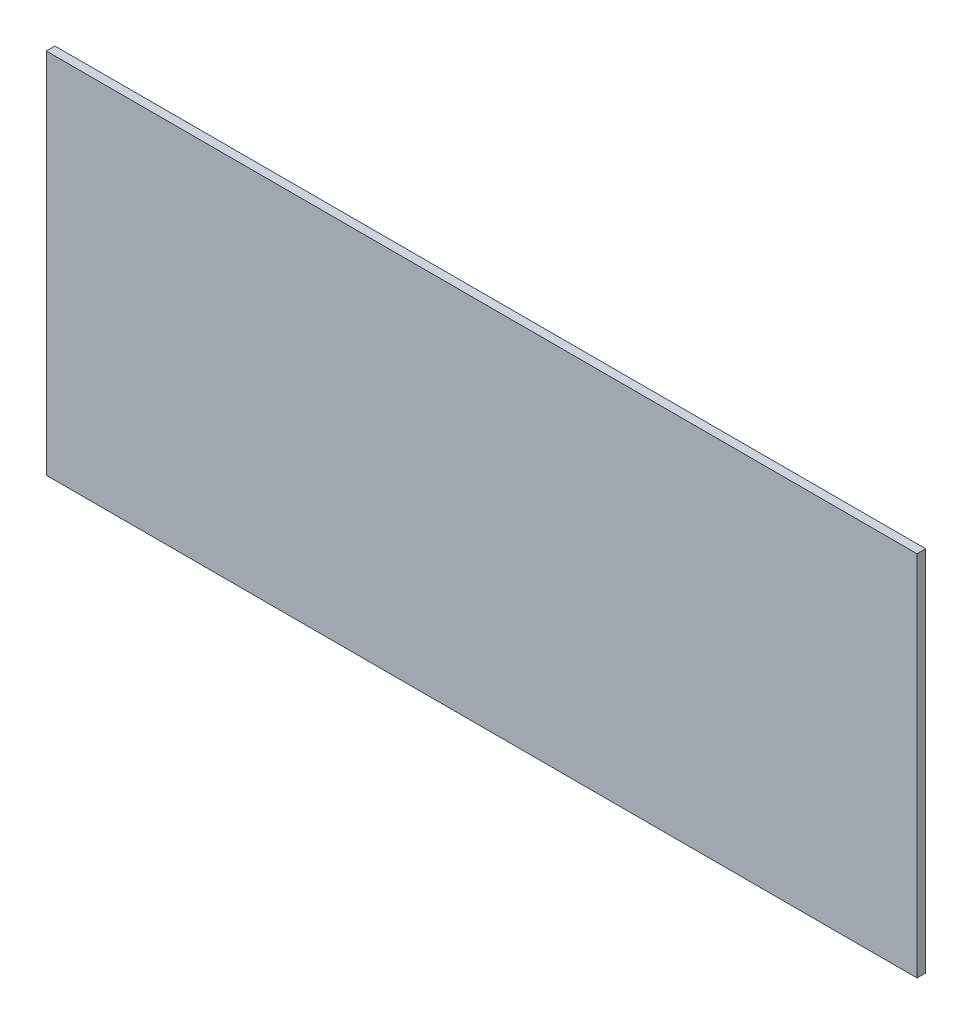
from build123d import *

# Parameters (mm, degrees)
ESQUISSE1_W        = 301
ESQUISSE1_H        = 127
BOSS_EXTRU_1_DEPTH = 3


with BuildPart() as part:
    # Esquisse1 → Boss.-Extru.1 (new body)
    with BuildSketch(Plane.XY):
        with Locations((-150.5, 63.5)):
            Rectangle(ESQUISSE1_W, ESQUISSE1_H)
    extrude(amount=BOSS_EXTRU_1_DEPTH)


solid = part.part
